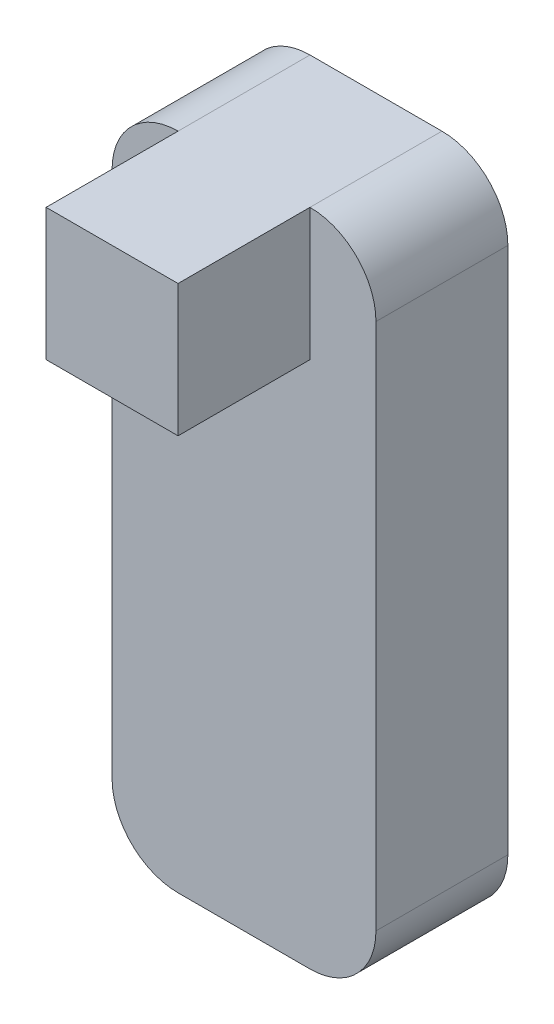
from build123d import *

# Parameters (mm, degrees)
SALIENTE_EXTRUIR1_DEPTH = 20
CORTAR_EXTRUIR1_DEPTH   = 8
CROQUIS3_W              = 20
CROQUIS3_H              = 20
SALIENTE_EXTRUIR2_DEPTH = 20


with BuildPart() as part:
    # Croquis1 → Saliente-Extruir1 (new body)
    with BuildSketch(Plane.XY):
        with BuildLine():
            Line((0, 90), (0, 10))
            Line((0, 10), (17.5, 10))
            ThreePointArc((17.5, 10), (20, 12.5), (22.5, 10))
            Line((22.5, 10), (40, 10))
            Line((40, 10), (40, 90))
            ThreePointArc((40, 90), (37.071067812, 97.071067812), (30, 100))
            Line((30, 100), (10, 100))
            ThreePointArc((10, 100), (2.928932188, 97.071067812), (0, 90))
        make_face()
        with BuildLine():
            Line((17.5, 10), (0, 10))
            ThreePointArc((0, 10), (2.928932188, 2.928932188), (10, 0))
            Line((10, 0), (30, 0))
            ThreePointArc((30, 0), (37.071067812, 2.928932188), (40, 10))
            Line((40, 10), (22.5, 10))
            ThreePointArc((22.5, 10), (22.371708245, 9.209430585), (22, 8.5))
            ThreePointArc((22, 8.5), (20, 7.5), (18, 8.5))
            ThreePointArc((18, 8.5), (17.628291755, 9.209430585), (17.5, 10))
        make_face()
        with BuildLine():
            ThreePointArc((22.5, 10), (20, 12.5), (17.5, 10))
            ThreePointArc((17.5, 10), (17.628291755, 9.209430585), (18, 8.5))
            Line((18, 8.5), (22, 8.5))
            ThreePointArc((22, 8.5), (22.371708245, 9.209430585), (22.5, 10))
        make_face()
        with BuildLine():
            Line((22, 8.5), (18, 8.5))
            ThreePointArc((18, 8.5), (20, 7.5), (22, 8.5))
        make_face()
    extrude(amount=SALIENTE_EXTRUIR1_DEPTH)

    # Croquis2 → Cortar-Extruir1 (cut)
    with BuildSketch(Plane(origin=(0, 0, 0), x_dir=(-1, 0, 0), z_dir=(0, 0, -1))):
        with BuildLine():
            Line((-22, 8.5), (-20, 8.5))
            Line((-20, 8.5), (-18, 8.5))
            ThreePointArc((-18, 8.5), (-17.628291755, 9.209430585), (-17.5, 10))
            ThreePointArc((-17.5, 10), (-20.790569415, 12.371708245), (-22, 8.5))
        make_face()
    extrude(amount=-CORTAR_EXTRUIR1_DEPTH, mode=Mode.SUBTRACT)

    # Croquis3 → Saliente-Extruir2 (add)
    with BuildSketch(Plane(origin=(0, 100, 0), x_dir=(1, 0, 0), z_dir=(0, 1, 0))):
        with Locations((20, -30)):
            Rectangle(CROQUIS3_W, CROQUIS3_H)
    extrude(amount=-SALIENTE_EXTRUIR2_DEPTH)


solid = part.part
